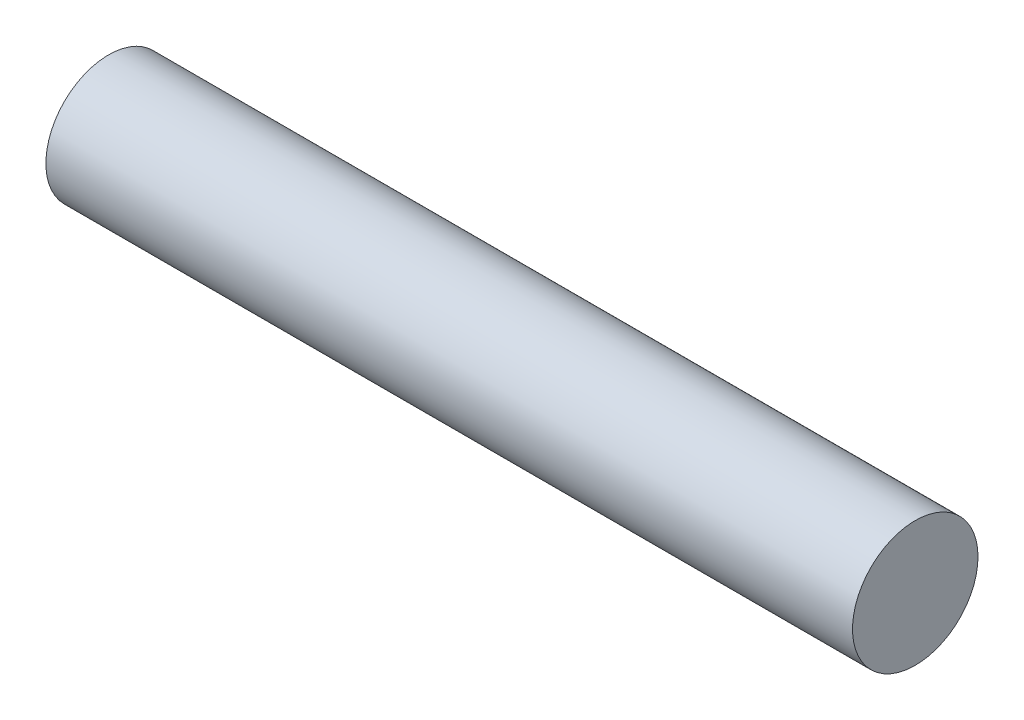
from build123d import *

# Parameters (mm, degrees)
SKETCH1_R           = 3.556
BOSS_EXTRUDE1_DEPTH = 22.86


with BuildPart() as part:
    # Sketch1 → Boss-Extrude1 (new, symmetric)
    with BuildSketch(Plane(origin=(0, 0, 0), x_dir=(0, 0, -1), z_dir=(1, 0, 0))):
        Circle(SKETCH1_R)
    extrude(amount=BOSS_EXTRUDE1_DEPTH, both=True)


solid = part.part
